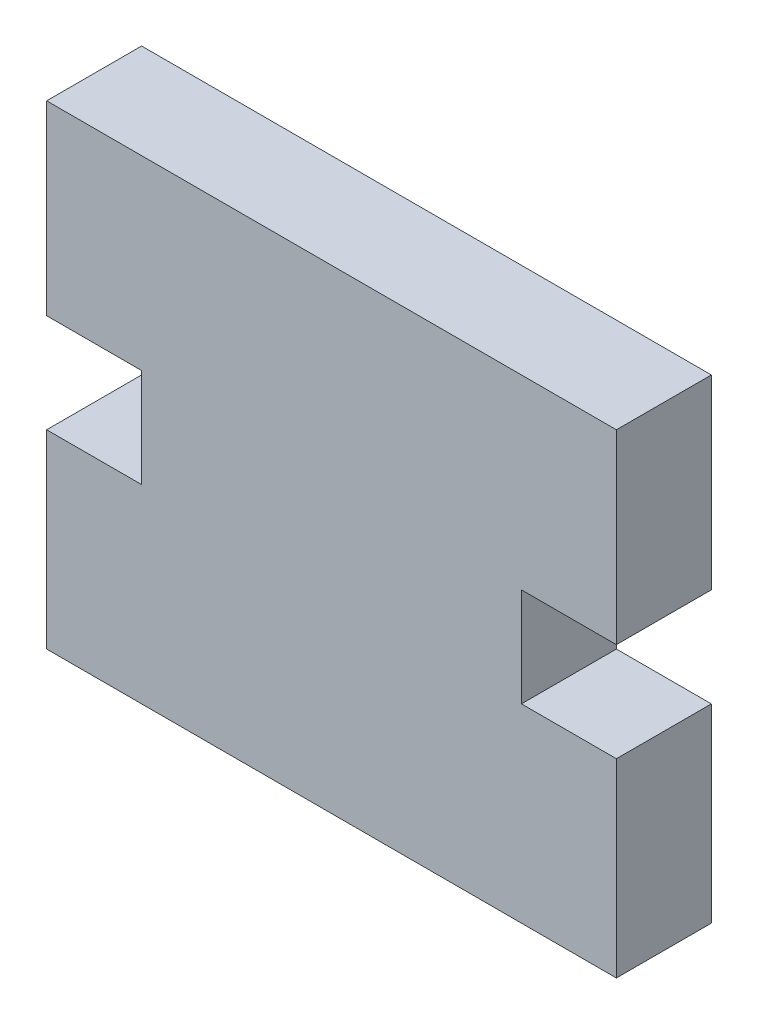
from build123d import *

# Parameters (mm, degrees)
BOSS_EXTRUDE1_DEPTH = 5


with BuildPart() as part:
    # Sketch1 → Boss-Extrude1 (new body)
    with BuildSketch(Plane.XY):
        Polygon((10, 2.7), (15, 2.7), (15, 12.5), (-15, 12.5), (-15, 2.7), (-10, 2.7), (-10, -2.5), (-15, -2.5), (-15, -12.5), (15, -12.5), (15, -2.5), (10, -2.5), align=None)
    extrude(amount=BOSS_EXTRUDE1_DEPTH)


solid = part.part
